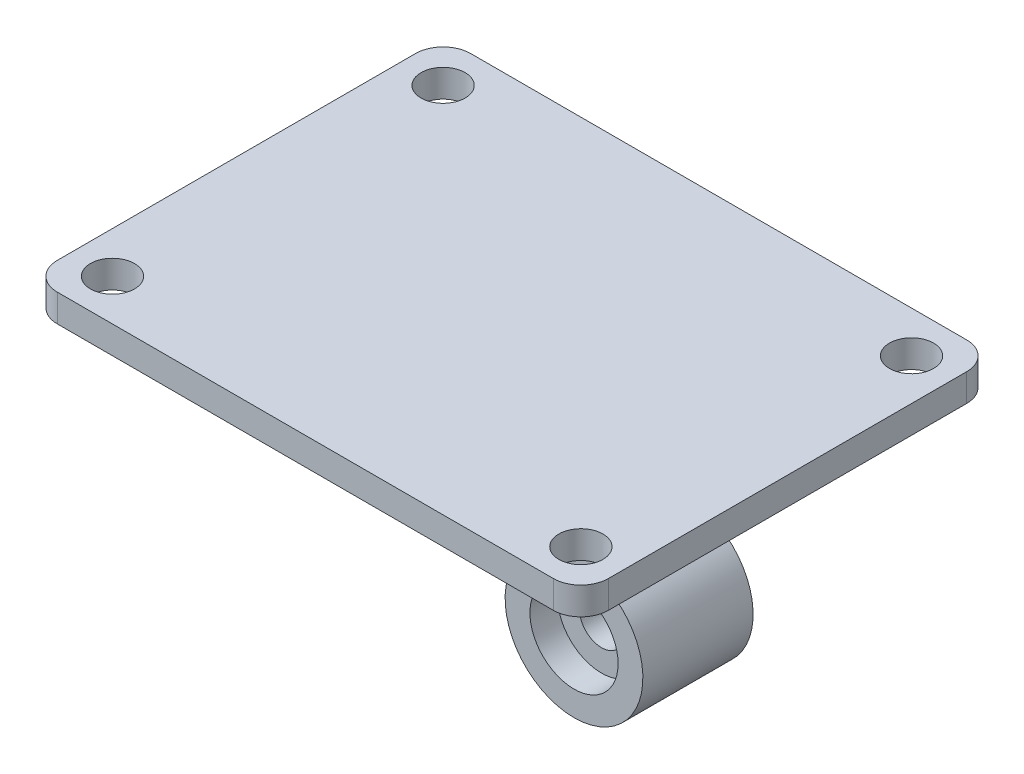
from build123d import *

# Parameters (mm, degrees)
SKETCH_1_R          = 1.6
EXTRUDE_1_DEPTH     = 8
SKETCH_2_R          = 3.2
CUT_EXTRUDE_1_DEPTH = 2
SKETCH_3_W          = 40
SKETCH_3_H          = 30
EXTRUDE_2_DEPTH     = 2
EXTRUDE_3_DEPTH     = 16
FILLET_1_R          = 2
SKETCH_4_R          = 1.6
CUT_EXTRUDE_3_DEPTH = 51.042481953


with BuildPart() as part:
    # Эскиз1 → Бобышка-Вытянуть1 (new body)
    with BuildSketch(Plane.XY):
        with BuildLine():
            ThreePointArc((-12.5, 9.330127019), (-10, 0), (-7.5, 9.330127019))
            Line((-7.5, 9.330127019), (-7.5, 13))
            Line((-7.5, 13), (-12.5, 13))
            Line((-12.5, 13), (-12.5, 9.330127019))
        make_face()
        with Locations((-10, 5)):
            Circle(SKETCH_1_R, mode=Mode.SUBTRACT)
    extrude(amount=-EXTRUDE_1_DEPTH)

    # Эскиз2 → Вырез-Вытянуть1 (cut)
    with BuildSketch(Plane.XY):
        with Locations((-10, 5)):
            Circle(SKETCH_2_R)
    extrude(amount=-CUT_EXTRUDE_1_DEPTH, mode=Mode.SUBTRACT)

    # Эскиз3 → Бобышка-Вытянуть2 (add)
    with BuildSketch(Plane(origin=(0, 13, 0), x_dir=(1, 0, 0), z_dir=(0, 1, 0))):
        with Locations((-22.5, 8)):
            Rectangle(SKETCH_3_W, SKETCH_3_H)
    extrude(amount=EXTRUDE_2_DEPTH)

    # Эскиз1<3> → Бобышка-Вытянуть3 (add)
    with BuildSketch(Plane.XY):
        with BuildLine():
            ThreePointArc((-12.5, 9.330127019), (-10, 10), (-7.5, 9.330127019))
            Line((-7.5, 9.330127019), (-7.5, 13))
            Line((-7.5, 13), (-12.5, 13))
            Line((-12.5, 13), (-12.5, 9.330127019))
        make_face()
    extrude(amount=-EXTRUDE_3_DEPTH)

    # Скругление1
    fillet_1_edges = [part.edges().sort_by_distance(p)[0] for p in [
        (-2.5, 14, -23),
        (-42.5, 14, -23),
        (-42.5, 14, 7),
        (-2.5, 14, 7),
    ]]
    fillet(fillet_1_edges, radius=FILLET_1_R)

    # Эскиз4 → Вырез-Вытянуть3 (cut, through all)
    with BuildSketch(Plane.XZ.offset(-13)):
        with Locations((-5.5, 4)):
            Circle(SKETCH_4_R)
        with Locations((-5.5, -20)):
            Circle(SKETCH_4_R)
        with Locations((-39.5, -20)):
            Circle(SKETCH_4_R)
        with Locations((-39.5, 4)):
            Circle(SKETCH_4_R)
    extrude(amount=-CUT_EXTRUDE_3_DEPTH, mode=Mode.SUBTRACT)


solid = part.part
